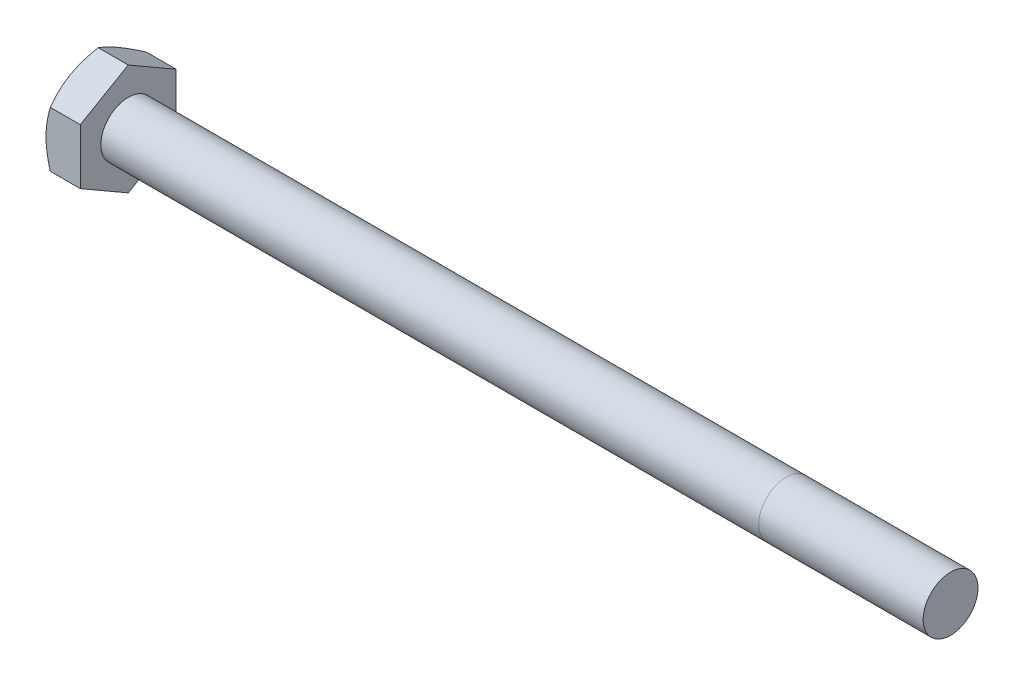
from build123d import *

# Parameters (mm, degrees)
SKETCH5_R           = 3.175
BOSS_EXTRUDE3_DEPTH = 95.25
BOSS_EXTRUDE4_DEPTH = 3.96875
SKETCH8_OUTSIDE_W   = 381.668
SKETCH8_OUTSIDE_H   = 383.388
SKETCH8_OUTSIDE_R   = 5.55625
CUT_EXTRUDE3_DEPTH  = 100.581096689
CUT_EXTRUDE3_DRAFT  = -60
CUT_EXTRUDE4_DEPTH  = 0.254
CIRPATTERN1_COUNT   = 3


with BuildPart() as part:
    # Sketch5 → Boss-Extrude3 (new body)
    with BuildSketch(Plane(origin=(49.609375, 0, 0), x_dir=(0, 0, -1), z_dir=(1, 0, 0))):
        Circle(SKETCH5_R)
    extrude(amount=-BOSS_EXTRUDE3_DEPTH)

    # Sketch11 → Revolve1 (revolve)
    with BuildSketch(Plane.XY):
        Polygon((-45.640625, 3.175), (-45.640625, 0), (33.734375, 0), (30.559375, 3.175), align=None)
    revolve(axis=Axis((-45.640625, 0, 0), (1, 0, 0)))

    # Sketch6 → Boss-Extrude4 (add)
    with BuildSketch(Plane.ZY.offset(45.640625)):
        Polygon((5.55625, 3.207902433), (0, 6.415804866), (-5.55625, 3.207902433), (-5.55625, -3.207902433), (0, -6.415804866), (5.55625, -3.207902433), align=None)
    extrude(amount=BOSS_EXTRUDE4_DEPTH)


with BuildPart() as cut_extrude3_tool:
    # Sketch8 outside → Cut-Extrude3 (with draft: the straight prism first)
    with BuildSketch(Plane.ZY.offset(49.609375)):
        Rectangle(SKETCH8_OUTSIDE_W, SKETCH8_OUTSIDE_H)
        Circle(SKETCH8_OUTSIDE_R, mode=Mode.SUBTRACT)
    extrude(amount=-CUT_EXTRUDE3_DEPTH)
    # Cut-Extrude3: the draft: its side faces are tilted about the plane it starts from
    cut_extrude3_sides = [cut_extrude3_tool.faces().sort_by_distance(p)[0] for p in [
        (0.681173344, -191.694, 0),
        (0.681173344, 0, 190.834),
        (0.681173344, 191.694, 0),
        (0.681173344, 0, -190.834),
        (0.681173344, 0, -5.55625),
    ]]
    draft(cut_extrude3_sides, Plane.ZY.offset(49.609375), CUT_EXTRUDE3_DRAFT)


with BuildPart() as part_1:
    add(part.part)

    # Cut-Extrude3: cut by cut_extrude3_tool
    add(cut_extrude3_tool.part, mode=Mode.SUBTRACT)

    # Sketch12 → Cut-Extrude4 (cut)
    with BuildSketch(Plane.ZY.offset(49.609375)):
        with BuildLine():
            Line((0.1666875, 4.2783125), (0.1666875, 2.3891875))
            ThreePointArc((0.1666875, 2.3891875), (0, 2.2225), (-0.1666875, 2.3891875))
            Line((-0.1666875, 2.3891875), (-0.1666875, 4.2783125))
            ThreePointArc((-0.1666875, 4.2783125), (0, 4.445), (0.1666875, 4.2783125))
        make_face()
    cut_extrude4 = extrude(amount=-CUT_EXTRUDE4_DEPTH, mode=Mode.SUBTRACT)

    # CirPattern1: Cut-Extrude4 ×3 about axis
    cirpattern1_axis = Axis((0, 0, 0), (1, 0, 0))
    for i in range(1, CIRPATTERN1_COUNT):
        add(cut_extrude4.rotate(cirpattern1_axis, i * 360 / CIRPATTERN1_COUNT), mode=Mode.SUBTRACT)


solid = part_1.part
